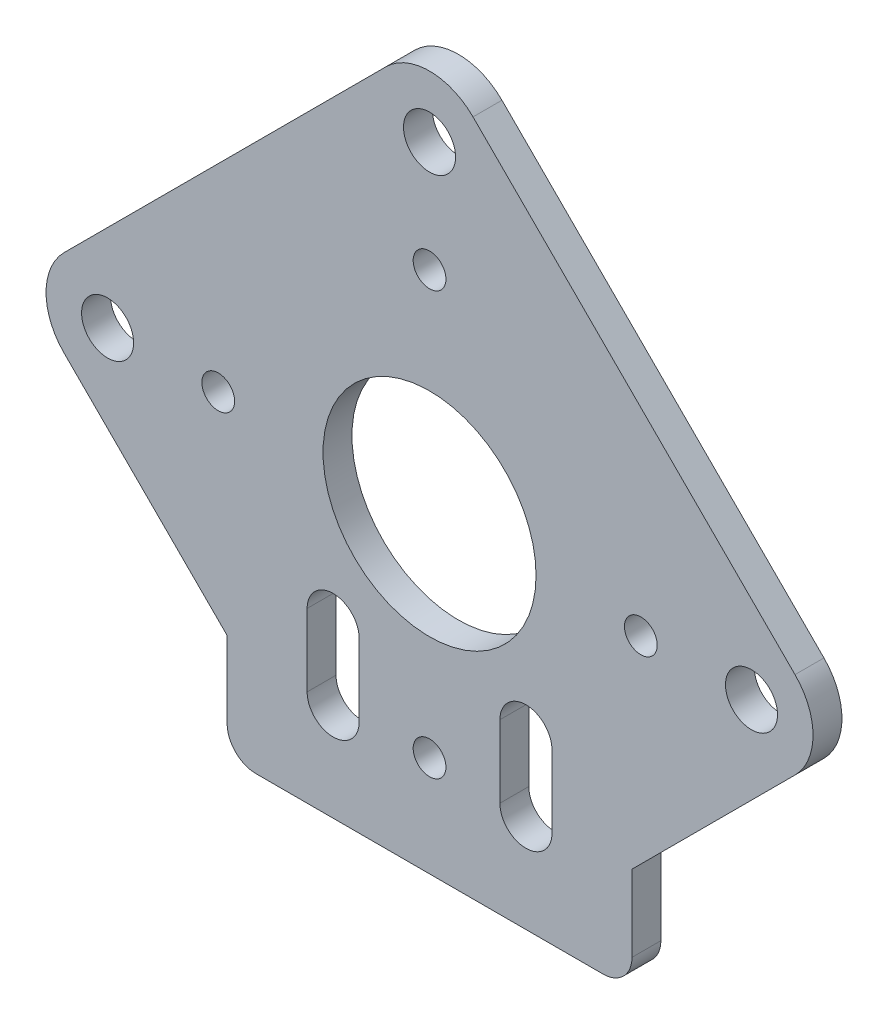
from build123d import *

# Parameters (mm, degrees)
MODEL_R                         = 1.7
MODEL_R_2                       = 11.05
MODEL_R_3                       = 2.7
AUFSATZ_LINEAR_AUSTRAGEN1_DEPTH = 3


with BuildPart() as part:
    # Model → Aufsatz-Linear austragen1 (new body)
    with BuildSketch(Plane.XY):
        with BuildLine():
            Line((19, 10.923593129), (19, 3))
            ThreePointArc((19, 3), (19.878679656, 0.878679656), (22, 0))
            Line((22, 0), (58, 0))
            ThreePointArc((58, 0), (60.121320344, 0.878679656), (61, 3))
            Line((61, 3), (61, 10.923593129))
            Line((61, 10.923593129), (77.915065607, 27.838658665))
            ThreePointArc((77.915065607, 27.838658665), (79.783724343, 32.349999929), (77.915065607, 36.861341193))
            Line((77.915065607, 36.861341193), (44.511341215, 70.265065599))
            ThreePointArc((44.511341215, 70.265065599), (39.999999949, 72.133724339), (35.488658682, 70.265065603))
            Line((35.488658682, 70.265065603), (2.084934387, 36.861341261))
            ThreePointArc((2.084934387, 36.861341261), (0.216275654, 32.349999998), (2.08493439, 27.838658736))
            Line((2.08493439, 27.838658736), (19, 10.923593129))
        make_face()
        with Locations((40, 10.429689783)):
            Circle(MODEL_R, mode=Mode.SUBTRACT)
        with Locations((61.920310217, 32.35)):
            Circle(MODEL_R, mode=Mode.SUBTRACT)
        with Locations((40, 54.270310217)):
            Circle(MODEL_R, mode=Mode.SUBTRACT)
        with Locations((18.079689783, 32.35)):
            Circle(MODEL_R, mode=Mode.SUBTRACT)
        with Locations((40, 32.35)):
            Circle(MODEL_R_2, mode=Mode.SUBTRACT)
        with Locations((73.4, 32.35)):
            Circle(MODEL_R_3, mode=Mode.SUBTRACT)
        with Locations((40, 65.75)):
            Circle(MODEL_R_3, mode=Mode.SUBTRACT)
        with Locations((6.6, 32.35)):
            Circle(MODEL_R_3, mode=Mode.SUBTRACT)
        with BuildLine():
            Line((32.7, 10), (32.7, 17.5))
            ThreePointArc((32.7, 17.5), (30, 20.2), (27.3, 17.5))
            Line((27.3, 17.5), (27.3, 10))
            ThreePointArc((27.3, 10), (30, 7.3), (32.7, 10))
        make_face(mode=Mode.SUBTRACT)
        with BuildLine():
            Line((47.3, 10), (47.3, 17.5))
            ThreePointArc((47.3, 17.5), (50, 20.2), (52.7, 17.5))
            Line((52.7, 17.5), (52.7, 10))
            ThreePointArc((52.7, 10), (50, 7.3), (47.3, 10))
        make_face(mode=Mode.SUBTRACT)
    extrude(amount=AUFSATZ_LINEAR_AUSTRAGEN1_DEPTH)


solid = part.part
